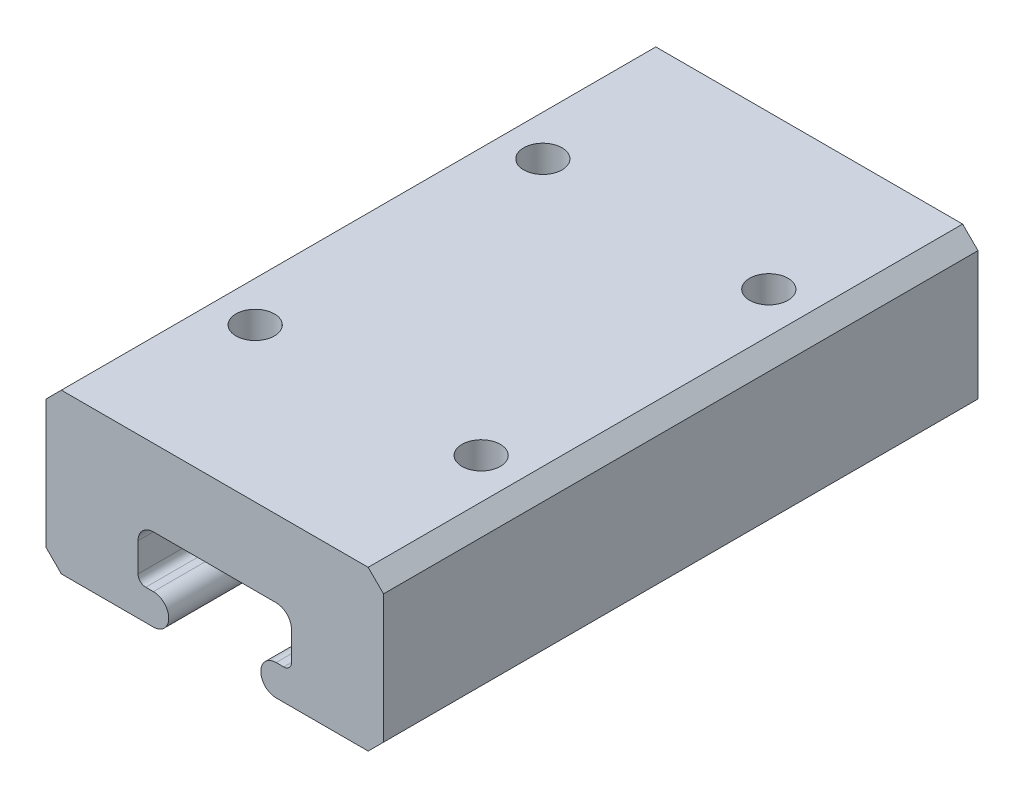
from build123d import *

# Parameters (mm, degrees)
BOSS_EXTRUDE2_DEPTH = 77.5
CHAMFER1_SIZE       = 2
SKETCH2_R           = 2.5
CUT_EXTRUDE1_DEPTH  = 7


with BuildPart() as part:
    # Sketch1 → Boss-Extrude2 (new body)
    with BuildSketch(Plane.XY):
        with BuildLine():
            Line((-8, 8.75), (8, 8.75))
            ThreePointArc((8, 8.75), (9.414213562, 8.164213562), (10, 6.75))
            Line((10, 6.75), (10, 3))
            ThreePointArc((10, 3), (9.707106781, 2.292893219), (9, 2))
            Line((9, 2), (8, 2))
            ThreePointArc((8, 2), (6, 0), (8, -2))
            Line((8, -2), (9, -2))
            Line((9, -2), (22, -2))
            Line((22, -2), (22, 18.75))
            Line((22, 18.75), (-22, 18.75))
            Line((-22, 18.75), (-22, -2))
            Line((-22, -2), (-9, -2))
            Line((-9, -2), (-8, -2))
            ThreePointArc((-8, -2), (-6, 0), (-8, 2))
            Line((-8, 2), (-9, 2))
            ThreePointArc((-9, 2), (-9.707106781, 2.292893219), (-10, 3))
            Line((-10, 3), (-10, 6.75))
            ThreePointArc((-10, 6.75), (-9.414213562, 8.164213562), (-8, 8.75))
        make_face()
    extrude(amount=BOSS_EXTRUDE2_DEPTH)

    # Chamfer1
    chamfer1_edges = [part.edges().sort_by_distance(p)[0] for p in [
        (-22, -2, 38.75),
        (-22, 18.75, 38.75),
        (22, 18.75, 38.75),
        (22, -2, 38.75),
    ]]
    chamfer(chamfer1_edges, length=CHAMFER1_SIZE)

    # Sketch2 → Cut-Extrude1 (cut)
    with BuildSketch(Plane(origin=(0, 18.75, 0), x_dir=(1, 0, 0), z_dir=(0, 1, 0))):
        with Locations(Location((14.728679071, -57.5, 0), (0, 0, 180))):
            Circle(SKETCH2_R)
        with Locations(Location((14.728679071, -20, 0), (0, 0, 180))):
            Circle(SKETCH2_R)
        with Locations((-14.728679071, -57.5)):
            Circle(SKETCH2_R)
        with Locations((-14.728679071, -20)):
            Circle(SKETCH2_R)
    extrude(amount=-CUT_EXTRUDE1_DEPTH, mode=Mode.SUBTRACT)


solid = part.part
